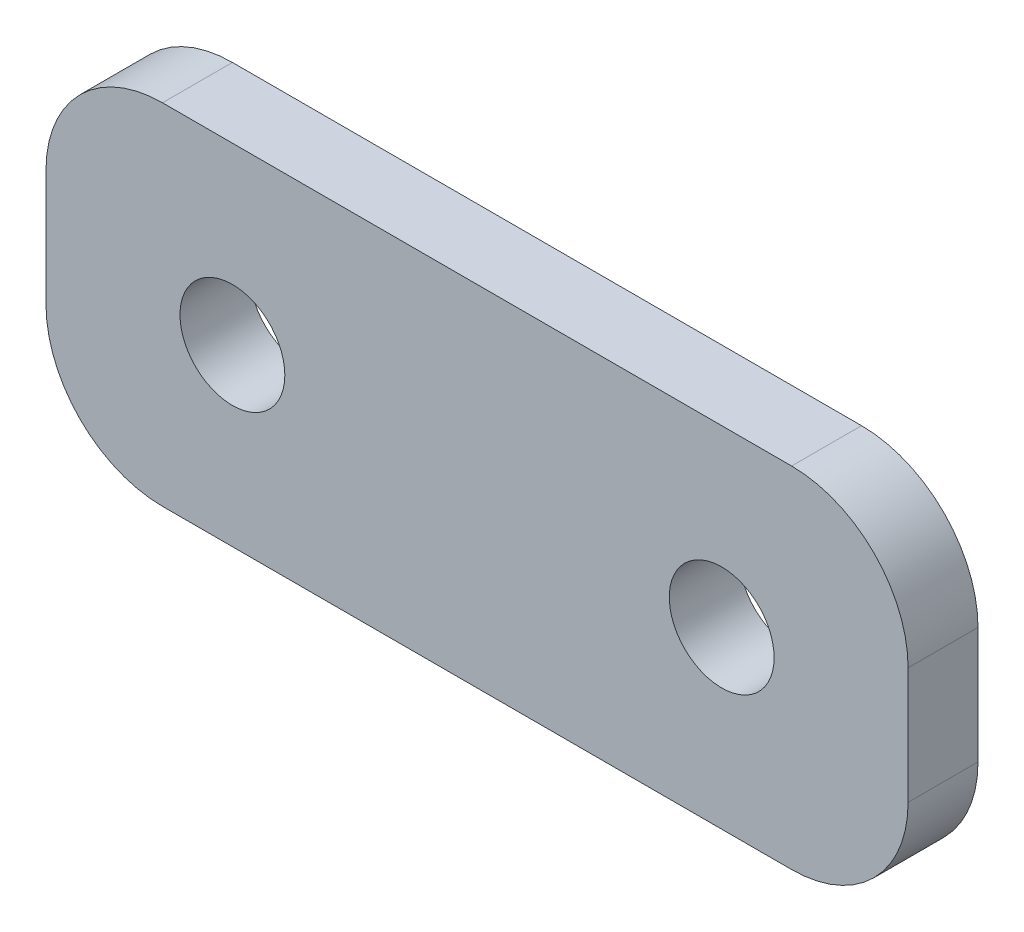
from build123d import *

# Parameters (mm, degrees)
SKETCH1_R           = 2.25
BOSS_EXTRUDE1_DEPTH = 3


with BuildPart() as part:
    # Sketch1 → Boss-Extrude1 (new body)
    with BuildSketch(Plane.XY):
        with BuildLine():
            Line((-13.5, -7.5), (13.5, -7.5))
            ThreePointArc((13.5, -7.5), (17.035533906, -6.035533906), (18.5, -2.5))
            Line((18.5, -2.5), (18.5, 2.5))
            ThreePointArc((18.5, 2.5), (17.035533906, 6.035533906), (13.5, 7.5))
            Line((13.5, 7.5), (-13.5, 7.5))
            ThreePointArc((-13.5, 7.5), (-17.035533906, 6.035533906), (-18.5, 2.5))
            Line((-18.5, 2.5), (-18.5, -2.5))
            ThreePointArc((-18.5, -2.5), (-17.035533906, -6.035533906), (-13.5, -7.5))
        make_face()
        with Locations((-10.5, 0)):
            Circle(SKETCH1_R, mode=Mode.SUBTRACT)
        with Locations((10.5, 0)):
            Circle(SKETCH1_R, mode=Mode.SUBTRACT)
    extrude(amount=BOSS_EXTRUDE1_DEPTH)


solid = part.part
